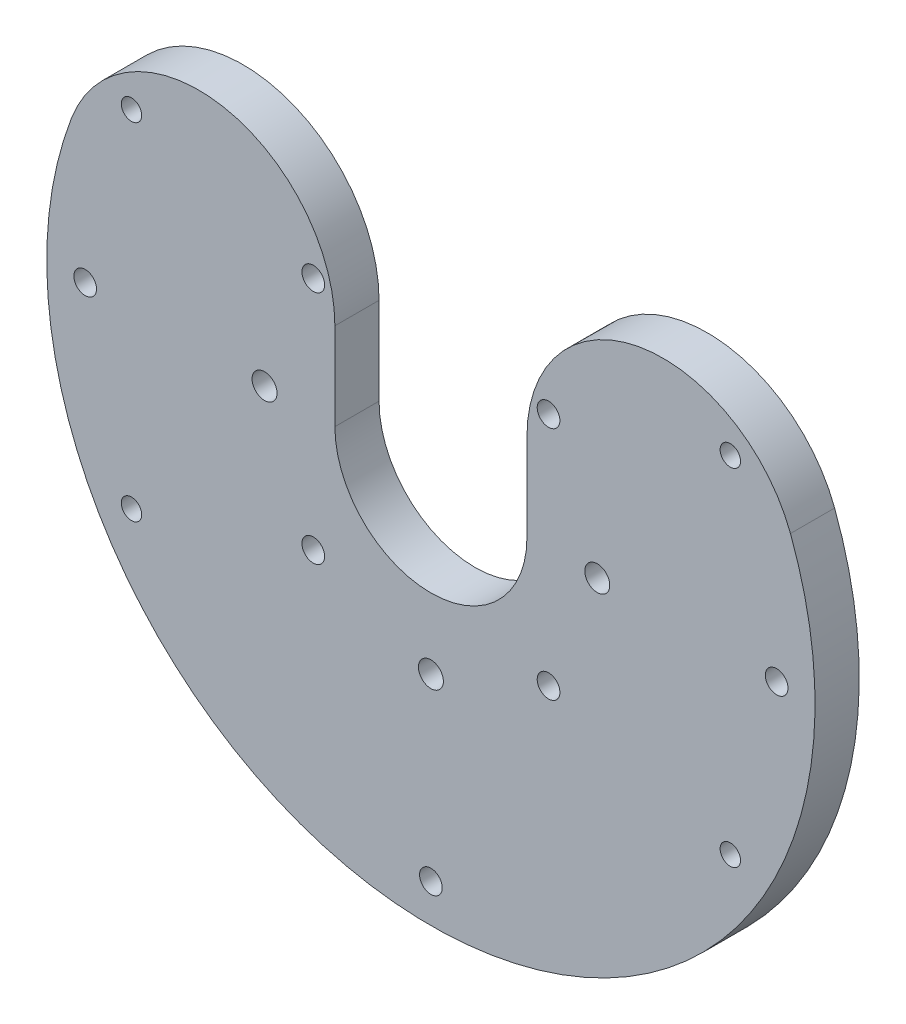
from build123d import *

# Parameters (mm, degrees)
SKETCH1_R           = 1.65
SKETCH1_R_2         = 1.5
SKETCH1_R_3         = 1.35
BOSS_EXTRUDE1_DEPTH = 5.842
FILLET1_R           = 18
SKETCH2_R           = 1.5
CUT_EXTRUDE1_DEPTH  = 73.079185373


with BuildPart() as part:
    # Sketch1 → Boss-Extrude1 (new body)
    with BuildSketch(Plane.XY):
        with BuildLine():
            Line((-12.7, 0), (-12.7, 49.186888497))
            ThreePointArc((-12.7, 49.186888497), (0, -50.8), (12.7, 49.186888497))
            Line((12.7, 49.186888497), (12.7, 0))
            ThreePointArc((12.7, 0), (0, -12.7), (-12.7, 0))
        make_face()
        with Locations((22, 0)):
            Circle(SKETCH1_R, mode=Mode.SUBTRACT)
        with Locations((0, -22)):
            Circle(SKETCH1_R, mode=Mode.SUBTRACT)
        with Locations((-22, 0)):
            Circle(SKETCH1_R, mode=Mode.SUBTRACT)
        with Locations((-45.72, 0)):
            Circle(SKETCH1_R_2, mode=Mode.SUBTRACT)
        with Locations((45.72, 0)):
            Circle(SKETCH1_R_2, mode=Mode.SUBTRACT)
        with Locations((0, -45.72)):
            Circle(SKETCH1_R_2, mode=Mode.SUBTRACT)
        with Locations((39.594681461, 22.86)):
            Circle(SKETCH1_R_3, mode=Mode.SUBTRACT)
        with Locations((39.594681461, -22.86)):
            Circle(SKETCH1_R_3, mode=Mode.SUBTRACT)
        with Locations((-39.594681461, -22.86)):
            Circle(SKETCH1_R_3, mode=Mode.SUBTRACT)
        with Locations((-39.594681461, 22.86)):
            Circle(SKETCH1_R_3, mode=Mode.SUBTRACT)
    extrude(amount=BOSS_EXTRUDE1_DEPTH)

    # Fillet1
    fillet1_edges = [part.edges().sort_by_distance(p)[0] for p in [
        (12.7, 49.186888497, 2.921),
        (-12.7, 49.186888497, 2.921),
    ]]
    fillet(fillet1_edges, radius=FILLET1_R)

    # Sketch2 → Cut-Extrude1 (cut, through all)
    with BuildSketch(Plane.XY.offset(5.842)):
        with Locations((-15.556349186, -15.556349186)):
            Circle(SKETCH2_R)
        with Locations((-15.556349186, 15.556349186)):
            Circle(SKETCH2_R)
        with Locations((15.556349186, 15.556349186)):
            Circle(SKETCH2_R)
        with Locations((15.556349186, -15.556349186)):
            Circle(SKETCH2_R)
    extrude(amount=-CUT_EXTRUDE1_DEPTH, mode=Mode.SUBTRACT)


solid = part.part
